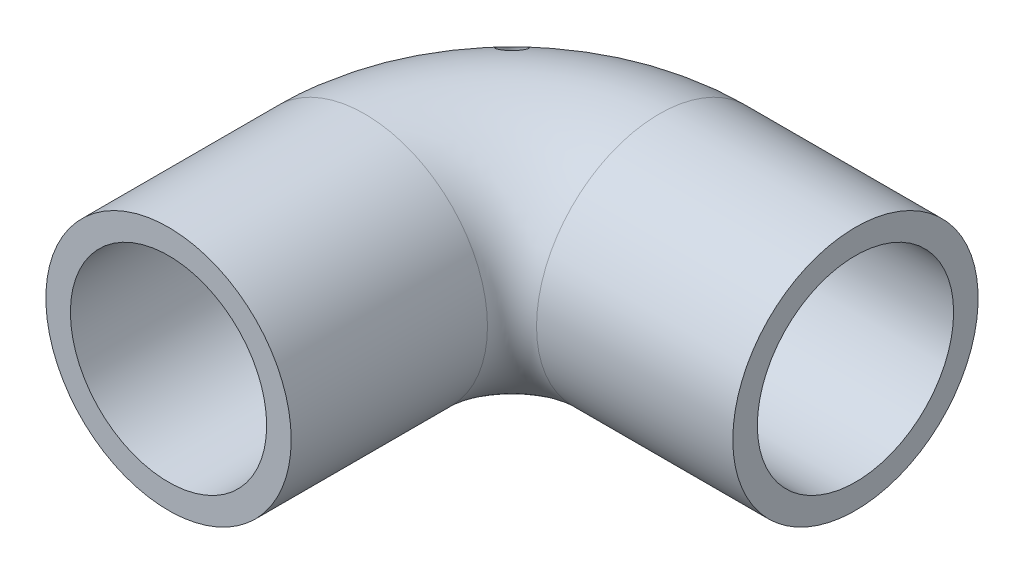
from build123d import *
from build123d.topology import SkipClean

# Parameters (mm, degrees)
SKETCH2_R               = 25
SHELL3_T                = -5
CUT_EXTRUDE2_DEPTH      = 117.726175321
CUT_EXTRUDE2_DEPTH_BACK = 96
SKETCH3_R               = 2.5


with BuildPart() as part:
    # Sweep7: sweep along a path in Sketch1
    with BuildLine(Plane(origin=(0, 0, 0), x_dir=(1, 0, 0), z_dir=(0, 1, 0))) as sweep7_path:
        Line((0, -90), (0, -50))
        ThreePointArc((0, -50), (8.786796564, -28.786796564), (30, -20))
        Line((30, -20), (70, -20))
    # Sketch2 → Sweep7 (sweep)
    with BuildSketch(Plane.XY.offset(90)):
        Circle(SKETCH2_R)
    sweep(path=sweep7_path.line)

    # Shell3
    shell3_openings = [part.faces().sort_by_distance(p)[0] for p in [
        (70, 0, 20),
        (0, 0, 90),
    ]]
    offset(amount=SHELL3_T, openings=shell3_openings, kind=Kind.INTERSECTION)

    # Sketch3 → Cut-Extrude2 (cut, two sides: drawn at the far end of the back side and taken through both)
    with SkipClean():  # the faces are left unmerged after this step: merging them gives an invalid solid
        with BuildSketch(Plane(origin=(0, 0, 0), x_dir=(1, 0, 0), z_dir=(0, 1, 0)).offset(-CUT_EXTRUDE2_DEPTH_BACK)):
            with Locations((0, -20)):
                Circle(SKETCH3_R)
        extrude(amount=CUT_EXTRUDE2_DEPTH + CUT_EXTRUDE2_DEPTH_BACK, mode=Mode.SUBTRACT)


solid = part.part
